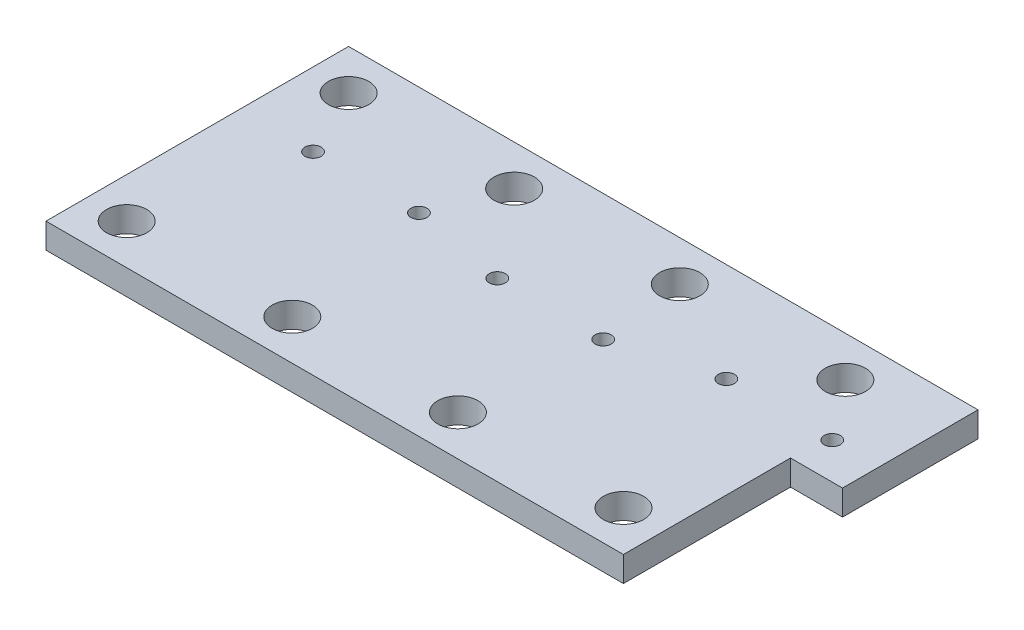
from build123d import *

# Parameters (mm, degrees)
SKETCH1_W                  = 229
SKETCH1_H                  = 120
BOSS_EXTRUDE1_DEPTH        = 5
SKETCH4_W                  = 20.632503002
SKETCH4_H                  = 53.730004003
BOSS_EXTRUDE2_DEPTH        = 10
F_16_0_16_DIAMETER_HOLE1_D = 16
M6_CLEARANCE_HOLE1_D       = 6.4


with BuildPart() as part:
    # Sketch1 → Boss-Extrude1 (new, symmetric)
    with BuildSketch(Plane(origin=(0, 0, 0), x_dir=(1, 0, 0), z_dir=(0, 1, 0))):
        with Locations((-114.5, 0)):
            Rectangle(SKETCH1_W, SKETCH1_H)
    extrude(amount=BOSS_EXTRUDE1_DEPTH, both=True)

    # Sketch4 → Boss-Extrude2 (add)
    with BuildSketch(Plane(origin=(0, 5, 0), x_dir=(1, 0, 0), z_dir=(0, 1, 0))):
        with Locations((10.316251501, 33.134997999)):
            Rectangle(SKETCH4_W, SKETCH4_H)
    extrude(amount=-BOSS_EXTRUDE2_DEPTH)

    # Ø16.0 (16) Diameter Hole1 (through all)
    with Locations(Plane(origin=(0, 5, 0), x_dir=(1, 0, 0), z_dir=(0, 1, 0))):
        with Locations((-213, 44), (-147.323, 44), (-81.646, 44), (-15.969, 44), (-213, -44), (-147.323, -44), (-81.646, -44), (-15.969, -44)):
            Hole(F_16_0_16_DIAMETER_HOLE1_D / 2)

    # M6 Clearance Hole1 (through all)
    with Locations(Plane(origin=(0, 5, 0), x_dir=(1, 0, 0), z_dir=(0, 1, 0))):
        with Locations((-199.875, 16.78), (-157.875, 16.78), (-119.875, 9.852366083), (-77.875, 9.852366083), (-39.875, 20.69101), (2.125, 20.69101)):
            Hole(M6_CLEARANCE_HOLE1_D / 2)


solid = part.part
